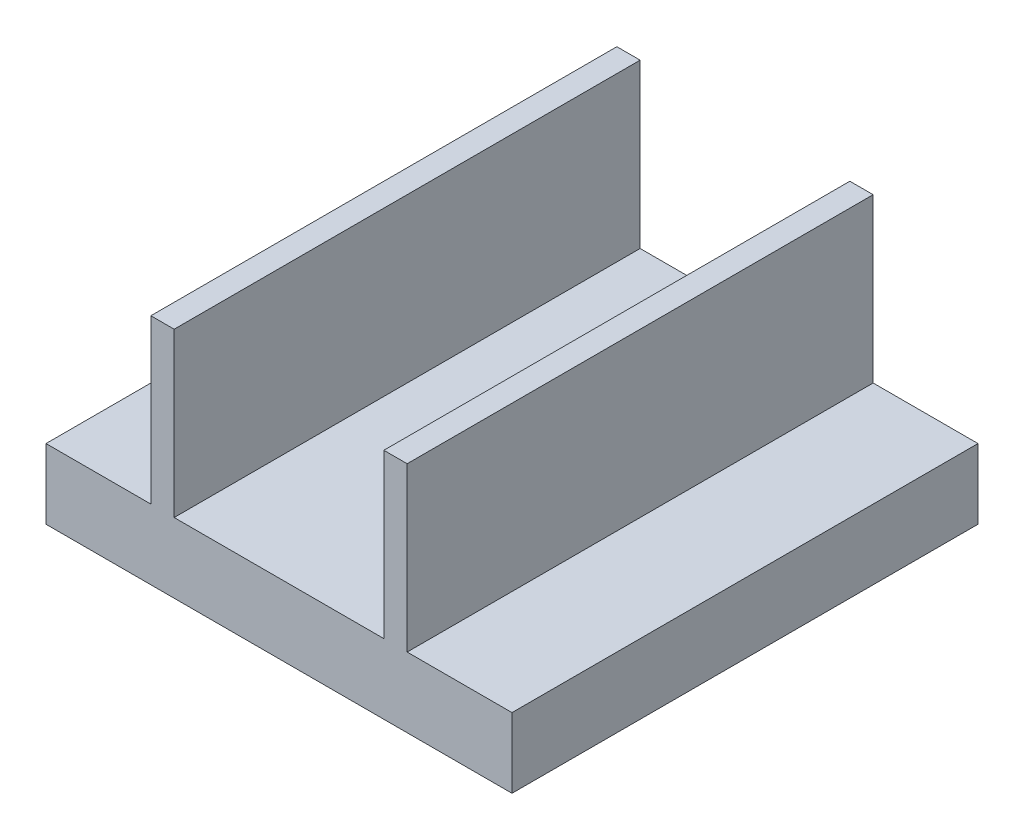
from build123d import *

# Parameters (mm, degrees)
EXTRUDE_1_DEPTH = 20


with BuildPart() as part:
    # Эскиз1 → Бобышка-Вытянуть1 (new body)
    with BuildSketch(Plane.XY):
        Polygon((0, 0), (20, 0), (20, 3), (15.5, 3), (15.5, 10), (14.5, 10), (14.5, 3), (5.5, 3), (5.5, 10), (4.5, 10), (4.5, 3), (0, 3), align=None)
    extrude(amount=EXTRUDE_1_DEPTH)


solid = part.part
